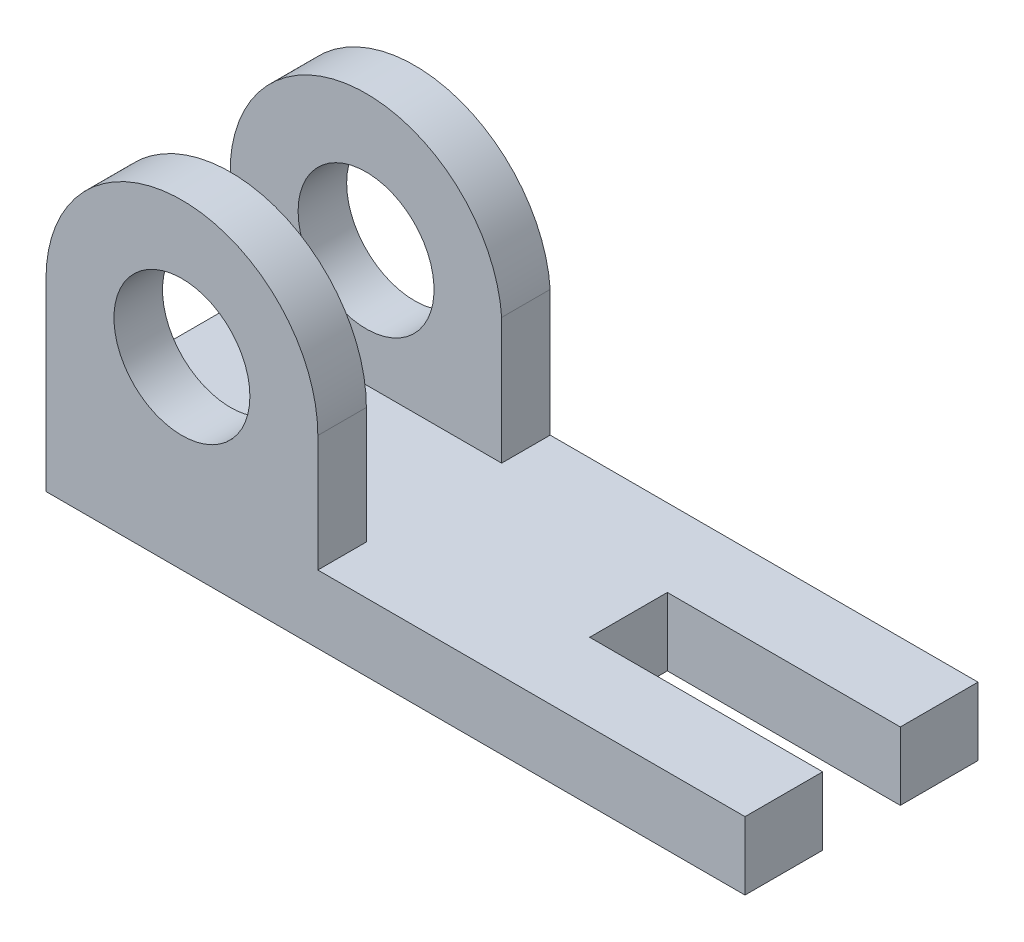
from build123d import *

# Parameters (mm, degrees)
SKETCH1_W           = 114.3
SKETCH1_H           = 11.1125
BOSS_EXTRUDE1_DEPTH = 19.05
SKETCH3_W           = 12.7
SKETCH3_H           = 11.1125
CUT_EXTRUDE1_DEPTH  = 38.1
SKETCH4_R           = 11.115
BOSS_EXTRUDE2_DEPTH = 7.9375
SKETCH5_R           = 11.1125
BOSS_EXTRUDE3_DEPTH = 7.9375


with BuildPart() as part:
    # Sketch1 → Boss-Extrude1 (new, symmetric)
    with BuildSketch(Plane.XY):
        Rectangle(SKETCH1_W, SKETCH1_H)
    extrude(amount=BOSS_EXTRUDE1_DEPTH, both=True)

    # Sketch3 → Cut-Extrude1 (cut)
    with BuildSketch(Plane(origin=(57.15, 0, 0), x_dir=(0, 0, -1), z_dir=(1, 0, 0))):
        Rectangle(SKETCH3_W, SKETCH3_H)
    extrude(amount=-CUT_EXTRUDE1_DEPTH, mode=Mode.SUBTRACT)

    # Sketch4 → Boss-Extrude2 (add)
    with BuildSketch(Plane.XY.offset(19.05)):
        with BuildLine():
            Line((-57.15, 24.60625), (-57.15, 5.55625))
            Line((-57.15, 5.55625), (-12.7, 5.55625))
            Line((-12.7, 5.55625), (-12.7, 24.60625))
            ThreePointArc((-12.7, 24.60625), (-19.209551788, 40.321698212), (-34.925, 46.83125))
            ThreePointArc((-34.925, 46.83125), (-50.640448212, 40.321698212), (-57.15, 24.60625))
        make_face()
        with Locations((-34.925, 24.60625)):
            Circle(SKETCH4_R, mode=Mode.SUBTRACT)
    extrude(amount=-BOSS_EXTRUDE2_DEPTH)

    # Sketch5 → Boss-Extrude3 (add)
    with BuildSketch(Plane(origin=(0, 0, -19.05), x_dir=(-1, 0, 0), z_dir=(0, 0, -1))):
        with BuildLine():
            Line((12.804049861, 5.55625), (57.15, 5.55625))
            Line((57.15, 5.55625), (57.15, 26.195))
            ThreePointArc((57.15, 26.195), (50.122971728, 40.875602864), (34.977024762, 46.83375))
            ThreePointArc((34.977024762, 46.83375), (19.83107801, 40.875602749), (12.804049861, 26.195))
            Line((12.804049861, 26.195), (12.804049861, 5.55625))
        make_face()
        with Locations((34.97702493, 24.60375)):
            Circle(SKETCH5_R, mode=Mode.SUBTRACT)
    extrude(amount=-BOSS_EXTRUDE3_DEPTH)


solid = part.part
